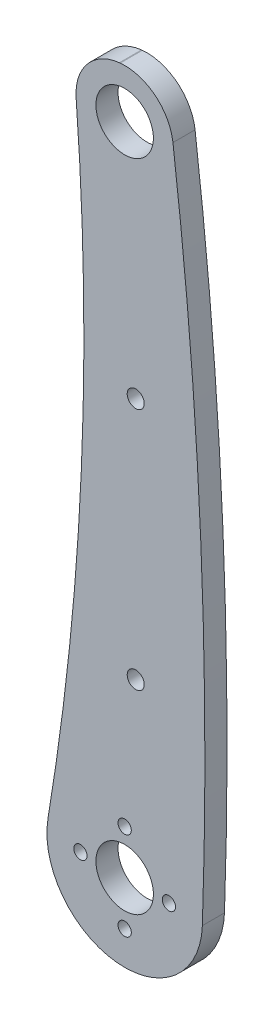
from build123d import *

# Parameters (mm, degrees)
SKETCH_1_R          = 1.925
SKETCH_1_R_2        = 0.925
SKETCH_1_R_3        = 6.5
EXTRUDE_1_DEPTH     = 5
SKETCH_2_R          = 1.5
CUT_EXTRUDE_1_DEPTH = 161.109426861


with BuildPart() as part:
    # 草图1 → 凸台-拉伸1 (new body)
    with BuildSketch(Plane.XY):
        with BuildLine():
            Line((-1.197146646, 158.934662313), (-0.998147001, 158.954620147))
            ThreePointArc((-0.998147001, 158.954620147), (6.901917658, 156.565251464), (10.916367847, 149.353851183))
            ThreePointArc((10.916367847, 149.353851183), (17.20705989, 74.502805076), (17.564366606, -0.61126978))
            ThreePointArc((17.564366606, -0.61126978), (11.601405763, -13.20181841), (-1.651060868, -17.497274731))
            Line((-1.651060868, -17.497274731), (-1.850065436, -17.477353429))
            ThreePointArc((-1.850065436, -17.477353429), (-13.988103687, -10.64018704), (-17.337003373, 2.882523033))
            ThreePointArc((-17.337003373, 2.882523033), (-9.795741354, 74.828468127), (-10.96780908, 147.159069574))
            ThreePointArc((-10.96780908, 147.159069574), (-8.465381447, 155.024052744), (-1.197146646, 158.934662313))
        make_face()
        with Locations((2.5, 40)):
            Circle(SKETCH_1_R, mode=Mode.SUBTRACT)
        with Locations((2.5, 95)):
            Circle(SKETCH_1_R, mode=Mode.SUBTRACT)
        with Locations((10, 0)):
            Circle(SKETCH_1_R_2, mode=Mode.SUBTRACT)
        with Locations((0, -10)):
            Circle(SKETCH_1_R_2, mode=Mode.SUBTRACT)
        with Locations((0, 10)):
            Circle(SKETCH_1_R_2, mode=Mode.SUBTRACT)
        with Locations((-10, 0)):
            Circle(SKETCH_1_R_2, mode=Mode.SUBTRACT)
        Circle(SKETCH_1_R_3, mode=Mode.SUBTRACT)
        with Locations((0, 148)):
            Circle(SKETCH_1_R_3, mode=Mode.SUBTRACT)
    extrude(amount=EXTRUDE_1_DEPTH)

    # 草图2 → 切除-拉伸1 (cut, through all)
    with BuildSketch(Plane.XY.offset(5)):
        with Locations((0, 10)):
            Circle(SKETCH_2_R)
        with Locations((10, 0)):
            Circle(SKETCH_2_R)
        with Locations((-10, 0)):
            Circle(SKETCH_2_R)
        with Locations((0, -10)):
            Circle(SKETCH_2_R)
    extrude(amount=-CUT_EXTRUDE_1_DEPTH, mode=Mode.SUBTRACT)


solid = part.part
